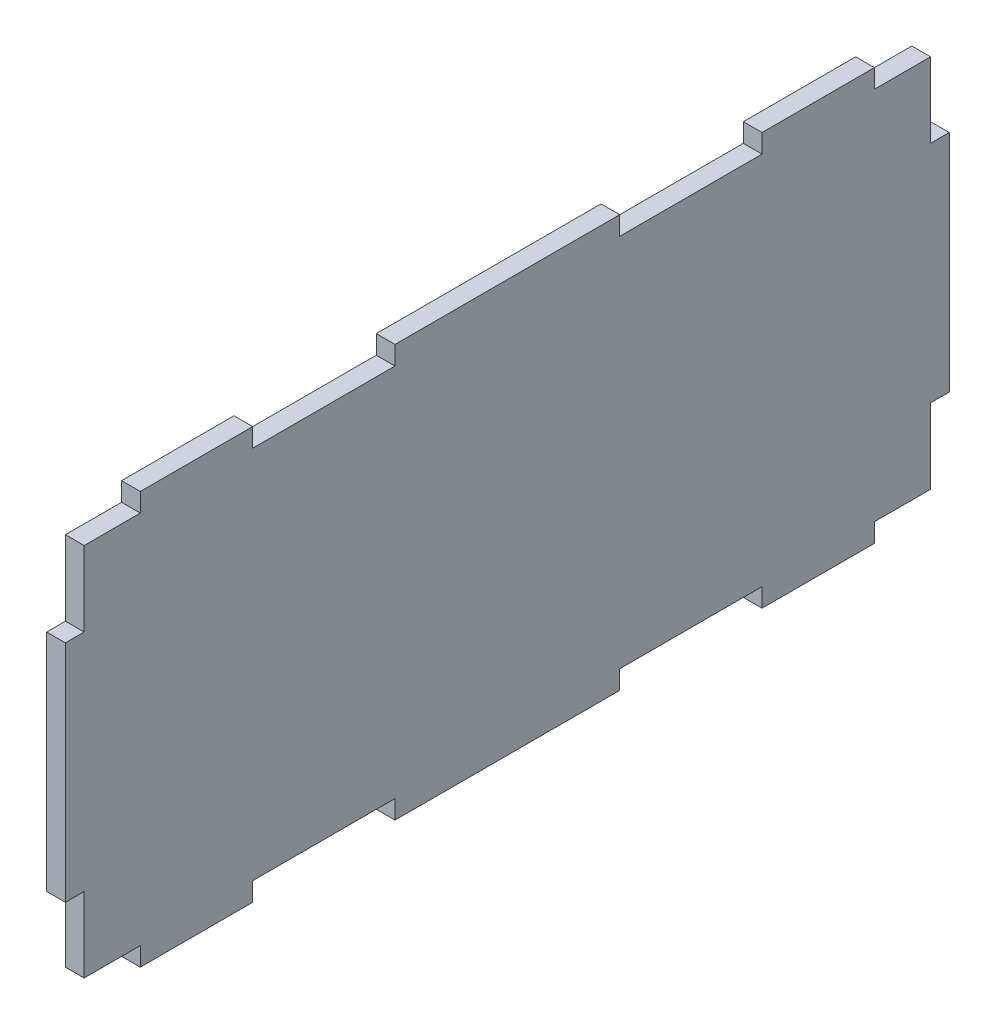
from build123d import *

# Parameters (mm, degrees)
SKETCH1_W           = 226
SKETCH1_H           = 100
SKETCH1_W_2         = 30
SKETCH1_H_2         = 5
SKETCH1_W_3         = 5
SKETCH1_H_3         = 60
SKETCH1_W_4         = 60
BOSS_EXTRUDE1_DEPTH = 5


with BuildPart() as part:
    # Sketch1 → Boss-Extrude1 (new body)
    with BuildSketch(Plane(origin=(0, 0, 0), x_dir=(0, 0, -1), z_dir=(1, 0, 0))):
        Rectangle(SKETCH1_W, SKETCH1_H)
        with Locations((-83, 52.5)):
            Rectangle(SKETCH1_W_2, SKETCH1_H_2)
        with Locations((-83, -52.5)):
            Rectangle(SKETCH1_W_2, SKETCH1_H_2)
        with Locations((-115.5, 0)):
            Rectangle(SKETCH1_W_3, SKETCH1_H_3)
        with Locations((83, 52.5)):
            Rectangle(SKETCH1_W_2, SKETCH1_H_2)
        with Locations((0, 52.5)):
            Rectangle(SKETCH1_W_4, SKETCH1_H_2)
        with Locations((0, -52.5)):
            Rectangle(SKETCH1_W_4, SKETCH1_H_2)
        with Locations((83, -52.5)):
            Rectangle(SKETCH1_W_2, SKETCH1_H_2)
        with Locations((115.5, 0)):
            Rectangle(SKETCH1_W_3, SKETCH1_H_3)
    extrude(amount=BOSS_EXTRUDE1_DEPTH)


solid = part.part
